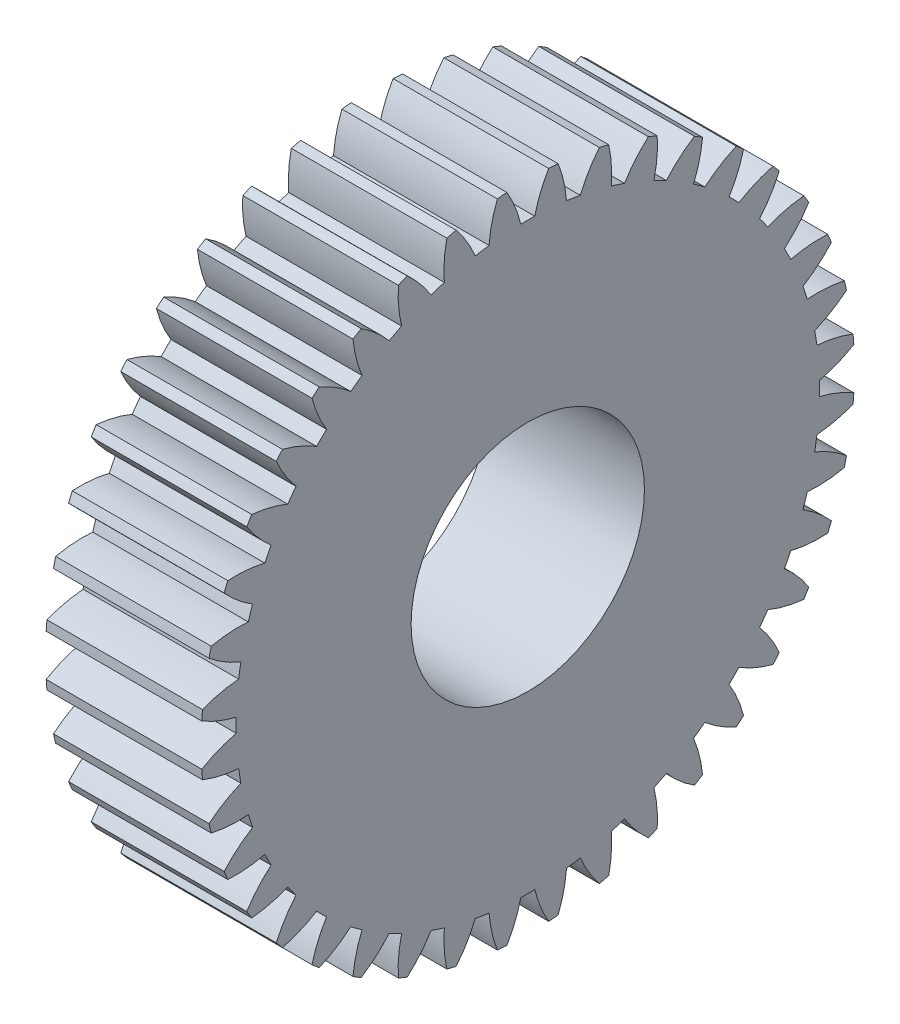
from build123d import *

# Parameters (mm, degrees)
BASPROSKE_W     = 10
BASPROSKE_H     = 21
TOOTHCUT_DEPTH  = 32.336879232
TEETHCUTS_COUNT = 40
TEETHCUTS_ANGLE = 351
BORSKE_R        = 7.5
BORE_DEPTH      = 50.0000508


with BuildPart() as part:
    # BasProSke → Base-Revolve (revolve)
    with BuildSketch(Plane(origin=(0, 0, 0), x_dir=(1, 0, 0), z_dir=(0, 1, 0)), mode=Mode.PRIVATE) as base_revolve_sk:
        with Locations((5, 10.5)):
            Rectangle(BASPROSKE_W, BASPROSKE_H)
    revolve(base_revolve_sk.sketch.rotate(Axis((-10, 0, 0), (1, 0, 0)), 180), axis=Axis((-10, 0, 0), (1, 0, 0)))

    # TooCutSke → ToothCut (cut, through all)
    with BuildSketch(Plane(origin=(0, 0, 0), x_dir=(0, 0, -1), z_dir=(1, 0, 0))):
        with BuildLine():
            ThreePointArc((0.448673268, 18.74363074), (0, 18.749), (-0.448673268, 18.74363074))
            ThreePointArc((-0.448673268, 18.74363074), (-0.816786816, 19.89705013), (-1.354745081, 20.981708961))
            ThreePointArc((-1.354745081, 20.981708961), (0, 21.0254), (1.354745081, 20.981708961))
            ThreePointArc((1.354745081, 20.981708961), (0.816786816, 19.89705013), (0.448673268, 18.74363074))
        make_face()
    toothcut = extrude(amount=TOOTHCUT_DEPTH, mode=Mode.SUBTRACT)

    # TeethCuts: ToothCut ×40 about axis
    teethcuts_axis = Axis((-10, 0, 0), (1, 0, 0))
    for i in range(1, TEETHCUTS_COUNT):
        add(toothcut.rotate(teethcuts_axis, i * TEETHCUTS_ANGLE / (TEETHCUTS_COUNT - 1)), mode=Mode.SUBTRACT)

    # BorSke → Bore (cut, symmetric)
    with BuildSketch(Plane(origin=(0, 0, 0), x_dir=(0, 0, -1), z_dir=(1, 0, 0))):
        with Locations(Location((0, 0, 0), (0, 0, 180))):
            Circle(BORSKE_R)
    extrude(amount=BORE_DEPTH, both=True, mode=Mode.SUBTRACT)


solid = part.part
